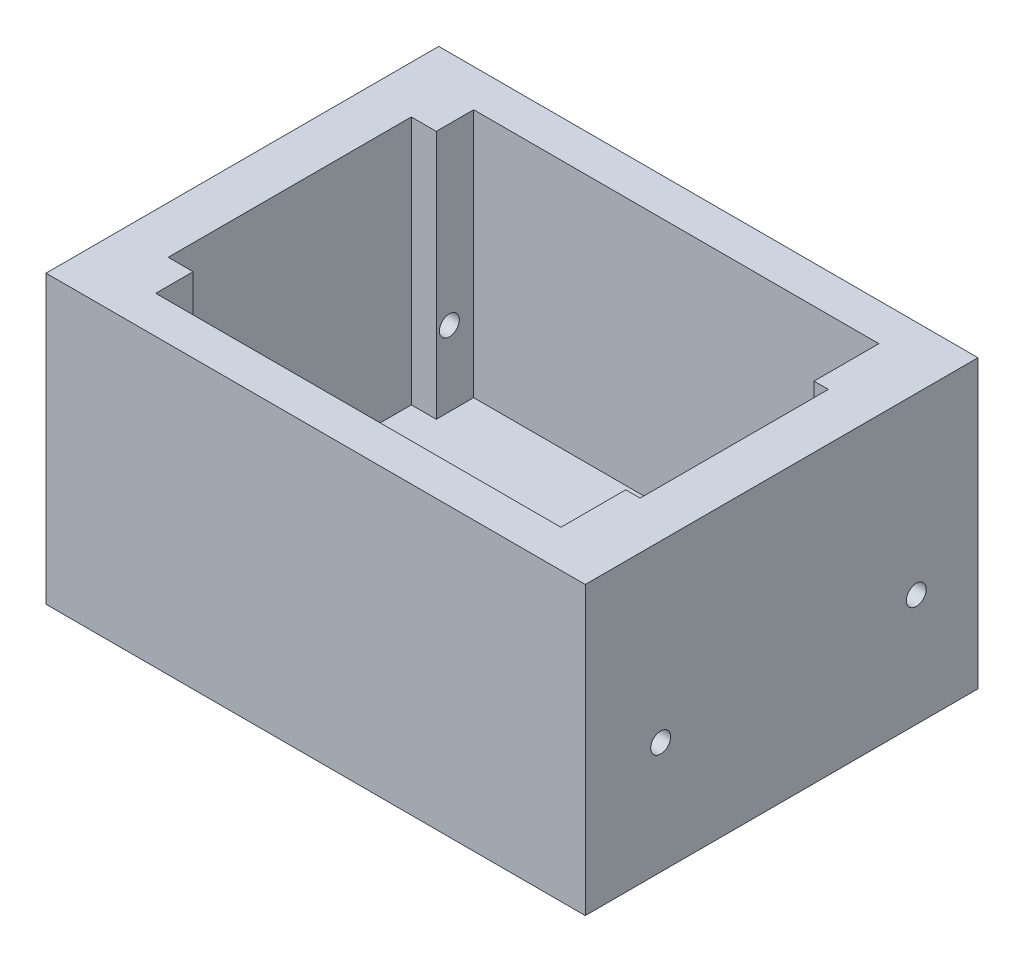
from build123d import *

# Parameters (mm, degrees)
SKETCH1_W               = 43.25
SKETCH1_H               = 31.5
BOSS_EXTRUDE1_DEPTH     = 23
CUT_EXTRUDE1_DEPTH      = 20
CUT_EXTRUDE2_DEPTH      = 55.663882043
CUT_EXTRUDE2_DEPTH_BACK = 55.663882043
SKETCH3_R               = 0.8


with BuildPart() as part:
    # Sketch1 → Boss-Extrude1 (new body)
    with BuildSketch(Plane(origin=(0, 0, 0), x_dir=(1, 0, 0), z_dir=(0, 1, 0))):
        with Locations((21.625, 15.75)):
            Rectangle(SKETCH1_W, SKETCH1_H)
    extrude(amount=BOSS_EXTRUDE1_DEPTH)

    # Sketch2 → Cut-Extrude1 (cut)
    with BuildSketch(Plane(origin=(0, 23, 0), x_dir=(1, 0, 0), z_dir=(0, 1, 0))):
        Polygon((38.3, 28.5), (5.8, 28.5), (5.8, 25.5), (3.8, 25.5), (3.8, 6), (5.8, 6), (5.8, 3), (38.3, 3), (38.3, 8.2), (39.45, 8.2), (39.45, 23.3), (38.3, 23.3), align=None)
    extrude(amount=-CUT_EXTRUDE1_DEPTH, mode=Mode.SUBTRACT)

    # Sketch3 → Cut-Extrude2 (cut, two sides: drawn at the far end of the back side and taken through both)
    with BuildSketch(Plane.ZY.offset(-38.3).offset(-CUT_EXTRUDE2_DEPTH_BACK)):
        with Locations((-26.55, 9)):
            Circle(SKETCH3_R)
        with Locations((-6.05, 9)):
            Circle(SKETCH3_R)
    extrude(amount=CUT_EXTRUDE2_DEPTH + CUT_EXTRUDE2_DEPTH_BACK, mode=Mode.SUBTRACT)


solid = part.part
